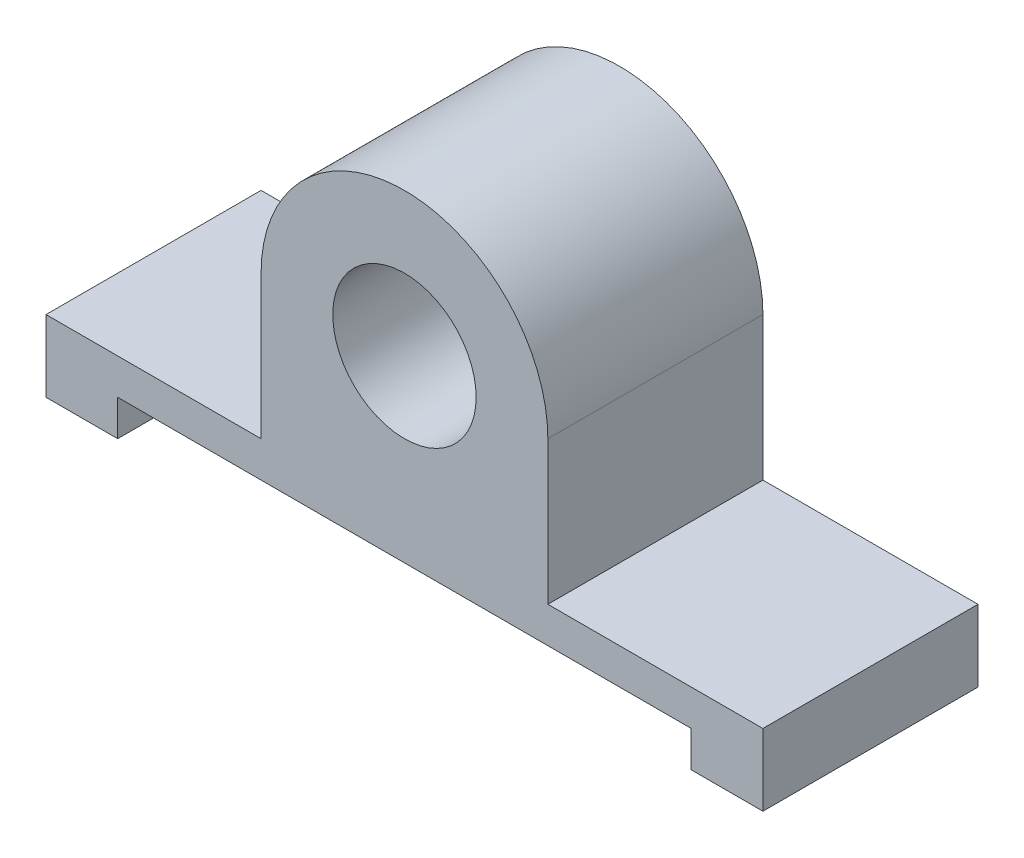
from build123d import *

# Parameters (mm, degrees)
SKETCH1_R           = 10
BOSS_EXTRUDE1_DEPTH = 30


with BuildPart() as part:
    # Sketch1 → Boss-Extrude1 (new body)
    with BuildSketch(Plane.XY):
        with BuildLine():
            Line((40, 0), (-40, 0))
            Line((-40, 0), (-40, -5))
            Line((-40, -5), (-50, -5))
            Line((-50, -5), (-50, 5))
            Line((-50, 5), (-20, 5))
            Line((-20, 5), (-20, 25))
            ThreePointArc((-20, 25), (0, 45), (20, 25))
            Line((20, 25), (20, 5))
            Line((20, 5), (50, 5))
            Line((50, 5), (50, -5))
            Line((50, -5), (40, -5))
            Line((40, -5), (40, 0))
        make_face()
        with Locations((0, 25)):
            Circle(SKETCH1_R, mode=Mode.SUBTRACT)
    extrude(amount=BOSS_EXTRUDE1_DEPTH)


solid = part.part
